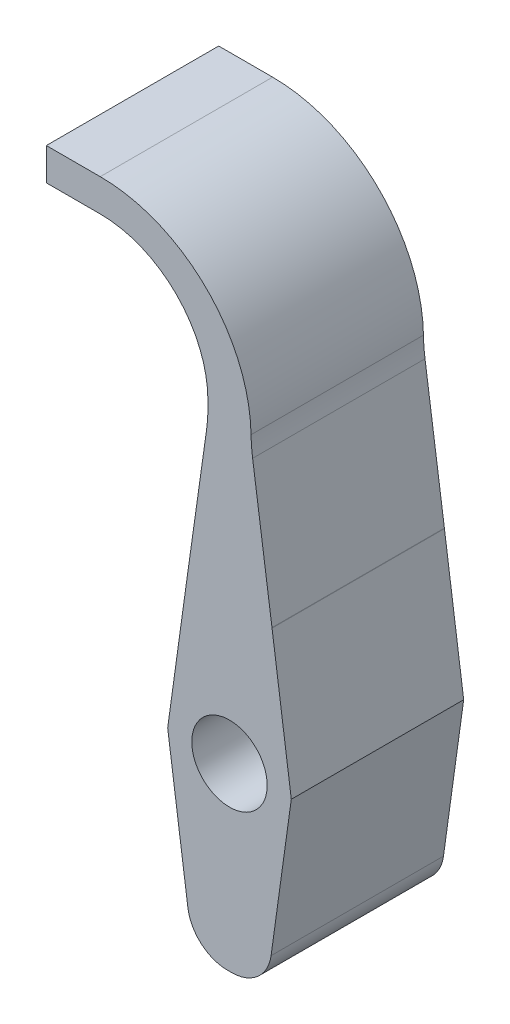
from build123d import *

# Parameters (mm, degrees)
BOSS_EXTRUDE1_DEPTH = 4
BOSS_EXTRUDE2_START = 12
SKETCH3_R           = 3.5
BOSS_EXTRUDE2_DEPTH = 12
SKETCH4_W           = 16
SKETCH4_H           = 3
BOSS_EXTRUDE3_DEPTH = 15
FILLET3_R           = 10
FILLET5_R           = 14


with BuildPart() as part:
    # Sketch2 → Boss-Extrude1 (new body)
    with BuildSketch(Plane.XY):
        with BuildLine():
            Line((-2, 41.178043508), (2, 41.178043508))
            Line((2, 41.178043508), (2, 27.712303128))
            ThreePointArc((2, 27.712303128), (2.036985125, 26.659599059), (2.147758114, 25.612086241))
            Line((2.147758114, 25.612086241), (3.94525946, 12.900577758))
            ThreePointArc((3.94525946, 12.900577758), (3.94789108, 12.8818827), (3.950499168, 12.863184344))
            Line((3.950499168, 12.863184344), (5.5790973, 1.133209829))
            Line((5.5790973, 1.133209829), (5.736432971, 0))
            Line((5.736432971, 0), (5.5790973, -1.133209829))
            Line((5.5790973, -1.133209829), (3.860857289, -13.50882979))
            ThreePointArc((3.860857289, -13.50882979), (2.625757677, -15.790400529), (0.196011829, -16.7))
            Line((0.196011829, -16.7), (-0.196011829, -16.7))
            ThreePointArc((-0.196011829, -16.7), (-2.625757677, -15.790400529), (-3.860857289, -13.50882979))
            Line((-3.860857289, -13.50882979), (-5.5790973, -1.133209829))
            Line((-5.5790973, -1.133209829), (-5.736432971, 0))
            Line((-5.736432971, 0), (-5.5790973, 1.133209829))
            Line((-5.5790973, 1.133209829), (-3.950499168, 12.863184344))
            ThreePointArc((-3.950499168, 12.863184344), (-3.94789108, 12.8818827), (-3.94525946, 12.900577758))
            Line((-3.94525946, 12.900577758), (-2.147758114, 25.612086241))
            ThreePointArc((-2.147758114, 25.612086241), (-2.036985125, 26.659599059), (-2, 27.712303128))
            Line((-2, 27.712303128), (-2, 41.178043508))
        make_face()
        with BuildLine():
            Line((-3.598099755, -0.858166699), (-1.879859743, -13.23378666))
            ThreePointArc((-1.879859743, -13.23378666), (-1.312381543, -14.282075919), (-0.196011829, -14.7))
            Line((-0.196011829, -14.7), (0.196011829, -14.7))
            ThreePointArc((0.196011829, -14.7), (1.312381543, -14.282075919), (1.879859743, -13.23378666))
            Line((1.879859743, -13.23378666), (3.598099755, -0.858166699))
            Line((3.598099755, -0.858166699), (3.717248239, 0))
            Line((3.717248239, 0), (3.598099755, 0.858166699))
            Line((3.598099755, 0.858166699), (1.879859743, 13.23378666))
            ThreePointArc((1.879859743, 13.23378666), (1.312381543, 14.282075919), (0.196011829, 14.7))
            Line((0.196011829, 14.7), (-0.196011829, 14.7))
            ThreePointArc((-0.196011829, 14.7), (-1.312381543, 14.282075919), (-1.879859743, 13.23378666))
            Line((-1.879859743, 13.23378666), (-3.598099755, 0.858166699))
            Line((-3.598099755, 0.858166699), (-3.717248239, 0))
            Line((-3.717248239, 0), (-3.598099755, -0.858166699))
        make_face(mode=Mode.SUBTRACT)
    extrude(amount=-BOSS_EXTRUDE1_DEPTH)

    # Sketch3 → Boss-Extrude2 (add)
    with BuildSketch(Plane.XY.offset(BOSS_EXTRUDE2_START)):
        with BuildLine():
            Line((-3.950499168, 12.863184344), (-5.736432971, 0))
            Line((-5.736432971, 0), (-3.860857289, -13.50882979))
            ThreePointArc((-3.860857289, -13.50882979), (-2.625757677, -15.790400529), (-0.196011829, -16.7))
            Line((-0.196011829, -16.7), (0.196011829, -16.7))
            ThreePointArc((0.196011829, -16.7), (2.625757677, -15.790400529), (3.860857289, -13.50882979))
            Line((3.860857289, -13.50882979), (5.736432971, 0))
            Line((5.736432971, 0), (3.950499168, 12.863184344))
            ThreePointArc((3.950499168, 12.863184344), (3.94789108, 12.8818827), (3.94525946, 12.900577758))
            Line((3.94525946, 12.900577758), (2.147758114, 25.612086241))
            ThreePointArc((2.147758114, 25.612086241), (2.036985125, 26.659599059), (2, 27.712303128))
            Line((2, 27.712303128), (2, 41.178043508))
            Line((2, 41.178043508), (-2, 41.178043508))
            Line((-2, 41.178043508), (-2, 27.712303128))
            ThreePointArc((-2, 27.712303128), (-2.036985125, 26.659599059), (-2.147758114, 25.612086241))
            Line((-2.147758114, 25.612086241), (-3.94525946, 12.900577758))
            ThreePointArc((-3.94525946, 12.900577758), (-3.94789108, 12.8818827), (-3.950499168, 12.863184344))
        make_face()
        Circle(SKETCH3_R, mode=Mode.SUBTRACT)
    extrude(amount=-BOSS_EXTRUDE2_DEPTH)

    # Sketch4 → Boss-Extrude3 (add)
    with BuildSketch(Plane.ZY.offset(2)):
        with Locations((4, 39.678043508)):
            Rectangle(SKETCH4_W, SKETCH4_H)
    extrude(amount=BOSS_EXTRUDE3_DEPTH)

    # Fillet3
    fillet3_edges = [part.edges().sort_by_distance(p)[0] for p in [
        (-2, 38.178043508, 4),
    ]]
    fillet(fillet3_edges, radius=FILLET3_R)

    # Fillet5
    fillet5_edges = [part.edges().sort_by_distance(p)[0] for p in [
        (2, 41.178043508, 4),
    ]]
    fillet(fillet5_edges, radius=FILLET5_R)


solid = part.part
